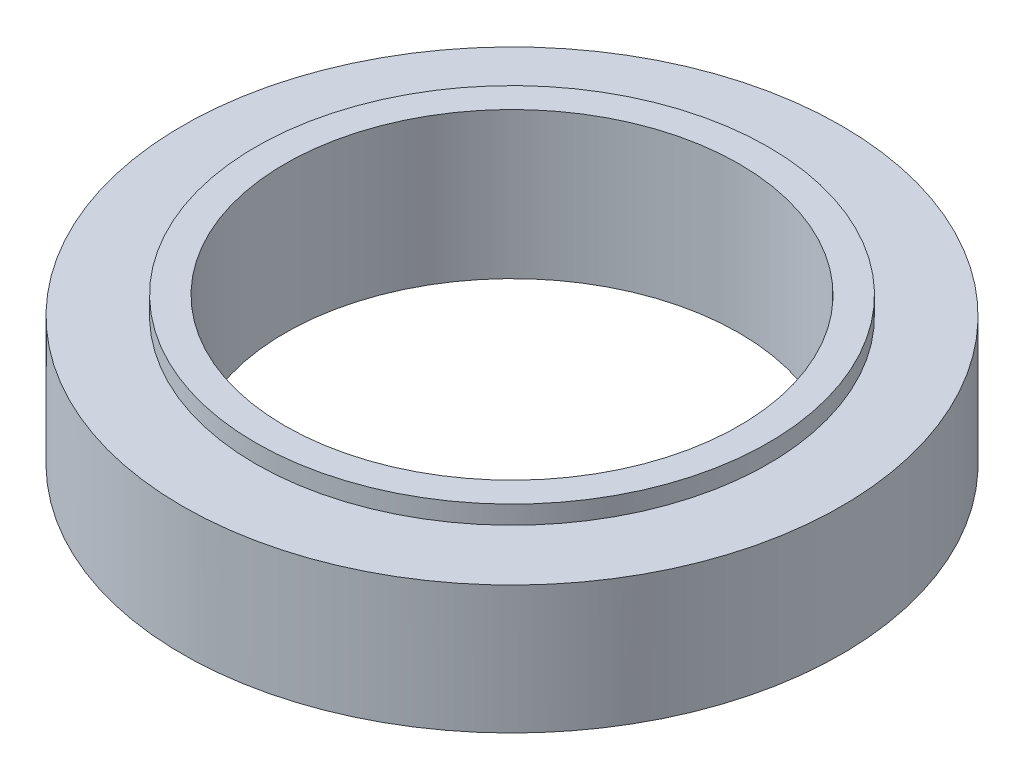
from build123d import *

# Parameters (mm, degrees)
SKETCH_1_R      = 7
SKETCH_1_R_2    = 6.2
EXTRUDE_1_DEPTH = 4
SKETCH_2_R      = 9
SKETCH_2_R_2    = 7
EXTRUDE_2_DEPTH = 3.5


with BuildPart() as part:
    # 草图1 → 凸台-拉伸1 (new body)
    with BuildSketch(Plane(origin=(0, 0, 0), x_dir=(1, 0, 0), z_dir=(0, 1, 0))):
        with Locations(Location((0, 0, 0), (0, 0, 270))):
            Circle(SKETCH_1_R)
        with Locations(Location((0, 0, 0), (0, 0, 270))):
            Circle(SKETCH_1_R_2, mode=Mode.SUBTRACT)
    extrude(amount=EXTRUDE_1_DEPTH)

    # 草图2 → 凸台-拉伸2 (add)
    with BuildSketch(Plane.XZ):
        with Locations(Location((0, 0, 0), (0, 0, 270))):
            Circle(SKETCH_2_R)
        with Locations(Location((0, 0, 0), (0, 0, 90))):
            Circle(SKETCH_2_R_2, mode=Mode.SUBTRACT)
    extrude(amount=-EXTRUDE_2_DEPTH)


solid = part.part
